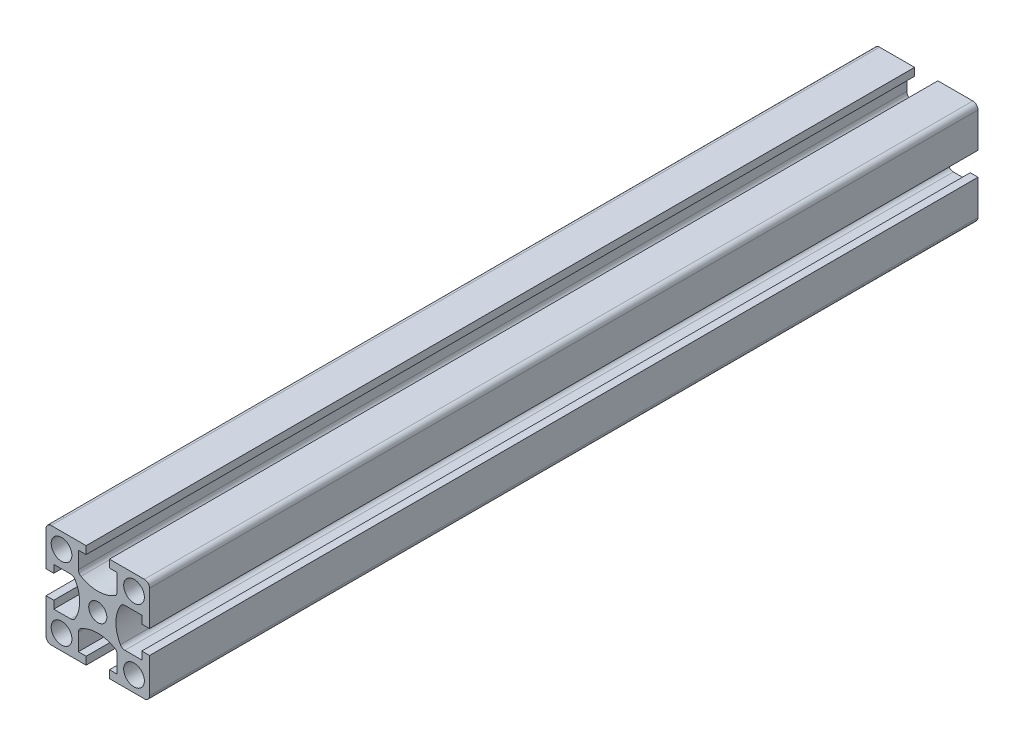
from build123d import *

# Parameters (mm, degrees)
SKETCH1_R           = 5
SKETCH1_R_2         = 4.375
BOSS_EXTRUDE1_DEPTH = 400


with BuildPart() as part:
    # Sketch1 → Boss-Extrude1 (new body)
    with BuildSketch(Plane.XY):
        with BuildLine():
            Line((-25, 22.5), (-25, 5.625))
            Line((-25, 5.625), (-21.25, 5.625))
            Line((-21.25, 5.625), (-21.25, 9.375))
            Line((-21.25, 9.375), (-13.092150698, 9.375))
            ThreePointArc((-13.092150698, 9.375), (-11.842150698, 9.040063509), (-10.927087189, 8.125))
            ThreePointArc((-10.927087189, 8.125), (-8.75, 0), (-10.927087189, -8.125))
            ThreePointArc((-10.927087189, -8.125), (-11.842150698, -9.040063509), (-13.092150698, -9.375))
            Line((-13.092150698, -9.375), (-21.25, -9.375))
            Line((-21.25, -9.375), (-21.25, -5.625))
            Line((-21.25, -5.625), (-25, -5.625))
            Line((-25, -5.625), (-25, -22.5))
            ThreePointArc((-25, -22.5), (-24.267766953, -24.267766953), (-22.5, -25))
            Line((-22.5, -25), (-5.625, -25))
            Line((-5.625, -25), (-5.625, -21.25))
            Line((-5.625, -21.25), (-9.375, -21.25))
            Line((-9.375, -21.25), (-9.375, -13.092150698))
            ThreePointArc((-9.375, -13.092150698), (-9.040063509, -11.842150698), (-8.125, -10.927087189))
            ThreePointArc((-8.125, -10.927087189), (0, -8.75), (8.125, -10.927087189))
            ThreePointArc((8.125, -10.927087189), (9.040063509, -11.842150698), (9.375, -13.092150698))
            Line((9.375, -13.092150698), (9.375, -21.25))
            Line((9.375, -21.25), (5.625, -21.25))
            Line((5.625, -21.25), (5.625, -25))
            Line((5.625, -25), (22.5, -25))
            ThreePointArc((22.5, -25), (24.267766953, -24.267766953), (25, -22.5))
            Line((25, -22.5), (25, -5.625))
            Line((25, -5.625), (21.25, -5.625))
            Line((21.25, -5.625), (21.25, -9.375))
            Line((21.25, -9.375), (13.092150698, -9.375))
            ThreePointArc((13.092150698, -9.375), (11.842150698, -9.040063509), (10.927087189, -8.125))
            ThreePointArc((10.927087189, -8.125), (8.75, 0), (10.927087189, 8.125))
            ThreePointArc((10.927087189, 8.125), (11.842150698, 9.040063509), (13.092150698, 9.375))
            Line((13.092150698, 9.375), (21.25, 9.375))
            Line((21.25, 9.375), (21.25, 5.625))
            Line((21.25, 5.625), (25, 5.625))
            Line((25, 5.625), (25, 22.5))
            ThreePointArc((25, 22.5), (24.267766953, 24.267766953), (22.5, 25))
            Line((22.5, 25), (5.625, 25))
            Line((5.625, 25), (5.625, 21.25))
            Line((5.625, 21.25), (9.375, 21.25))
            Line((9.375, 21.25), (9.375, 13.092150698))
            ThreePointArc((9.375, 13.092150698), (9.040063509, 11.842150698), (8.125, 10.927087189))
            ThreePointArc((8.125, 10.927087189), (0, 8.75), (-8.125, 10.927087189))
            ThreePointArc((-8.125, 10.927087189), (-9.040063509, 11.842150698), (-9.375, 13.092150698))
            Line((-9.375, 13.092150698), (-9.375, 21.25))
            Line((-9.375, 21.25), (-5.625, 21.25))
            Line((-5.625, 21.25), (-5.625, 25))
            Line((-5.625, 25), (-22.5, 25))
            ThreePointArc((-22.5, 25), (-24.267766953, 24.267766953), (-25, 22.5))
        make_face()
        with Locations((-17.5, -17.5)):
            Circle(SKETCH1_R, mode=Mode.SUBTRACT)
        with Locations((17.5, -17.5)):
            Circle(SKETCH1_R, mode=Mode.SUBTRACT)
        with Locations((17.5, 17.5)):
            Circle(SKETCH1_R, mode=Mode.SUBTRACT)
        Circle(SKETCH1_R_2, mode=Mode.SUBTRACT)
        with Locations((-17.5, 17.5)):
            Circle(SKETCH1_R, mode=Mode.SUBTRACT)
    extrude(amount=BOSS_EXTRUDE1_DEPTH)


solid = part.part
